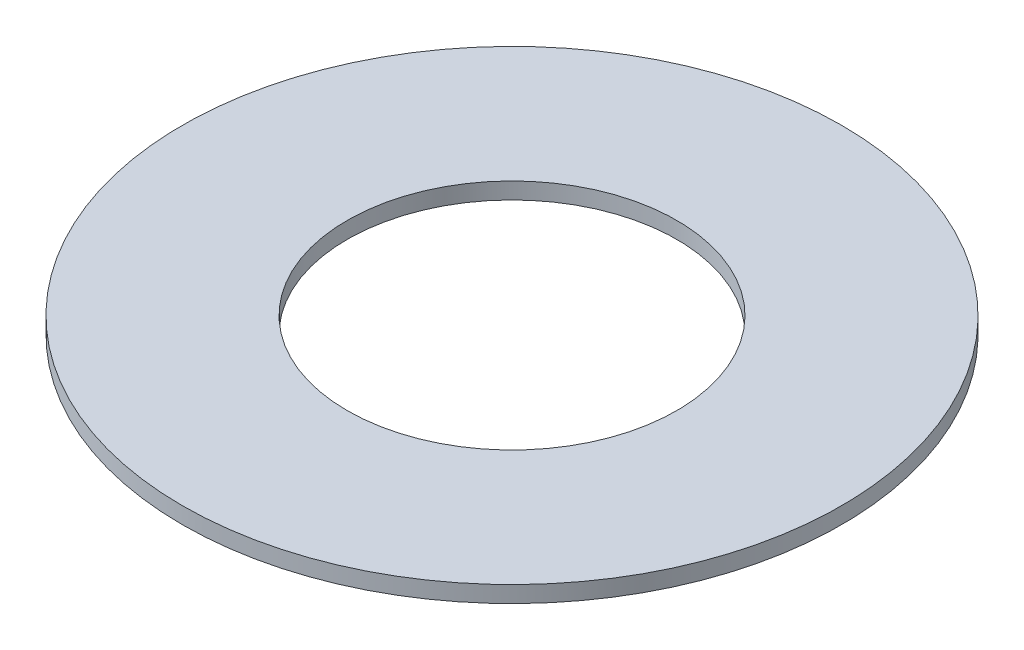
from build123d import *

# Parameters (mm, degrees)
ESBO_O1_R                = 10
ESBO_O1_R_2              = 5
RESSALTO_EXTRUS_O1_DEPTH = 0.5


with BuildPart() as part:
    # Esboço1 → Ressalto-extrusão1 (new body)
    with BuildSketch(Plane(origin=(0, 0, 0), x_dir=(1, 0, 0), z_dir=(0, 1, 0))):
        with Locations(Location((0, 0, 0), (0, 0, 270))):
            Circle(ESBO_O1_R)
        with Locations(Location((0, 0, 0), (0, 0, 270))):
            Circle(ESBO_O1_R_2, mode=Mode.SUBTRACT)
    extrude(amount=RESSALTO_EXTRUS_O1_DEPTH)


solid = part.part
